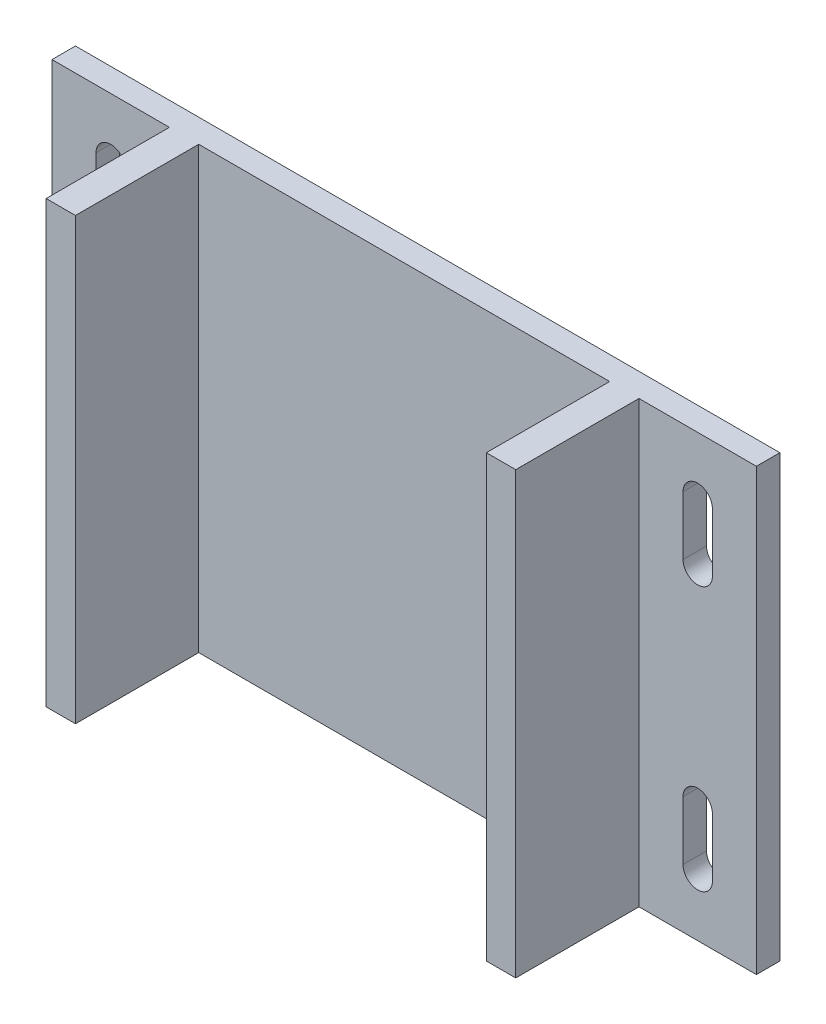
from build123d import *

# Parameters (mm, degrees)
SKETCH_1_W          = 120
SKETCH_1_H          = 75
EXTRUDE_1_DEPTH     = 4
SKETCH_2_W          = 5
SKETCH_2_H          = 75
EXTRUDE_2_DEPTH     = 21
CUT_EXTRUDE_1_DEPTH = 144.701078632


with BuildPart() as part:
    # 草图1 → 凸台-拉伸1 (new body)
    with BuildSketch(Plane.XY):
        with Locations((60, 37.5)):
            Rectangle(SKETCH_1_W, SKETCH_1_H)
    extrude(amount=EXTRUDE_1_DEPTH)

    # 草图2 → 凸台-拉伸2 (add)
    with BuildSketch(Plane.XY.offset(4)):
        with Locations((22.5, 37.5)):
            Rectangle(SKETCH_2_W, SKETCH_2_H)
        with Locations((97.5, 37.5)):
            Rectangle(SKETCH_2_W, SKETCH_2_H)
    extrude(amount=EXTRUDE_2_DEPTH)

    # 草图3 → 切除-拉伸1 (cut, through all)
    with BuildSketch(Plane(origin=(0, 0, 0), x_dir=(-1, 0, 0), z_dir=(0, 0, -1))):
        with BuildLine():
            Line((-112.5, 65), (-112.5, 55))
            ThreePointArc((-112.5, 55), (-110, 52.5), (-107.5, 55))
            Line((-107.5, 55), (-107.5, 65))
            ThreePointArc((-107.5, 65), (-110, 67.5), (-112.5, 65))
        make_face()
        with BuildLine():
            Line((-107.5, 10), (-107.5, 20))
            ThreePointArc((-107.5, 20), (-110, 22.5), (-112.5, 20))
            Line((-112.5, 20), (-112.5, 10))
            ThreePointArc((-112.5, 10), (-110, 7.5), (-107.5, 10))
        make_face()
        with BuildLine():
            Line((-7.5, 10), (-7.5, 20))
            ThreePointArc((-7.5, 20), (-10, 22.5), (-12.5, 20))
            Line((-12.5, 20), (-12.5, 10))
            ThreePointArc((-12.5, 10), (-10, 7.5), (-7.5, 10))
        make_face()
        with BuildLine():
            Line((-12.5, 65), (-12.5, 55))
            ThreePointArc((-12.5, 55), (-10, 52.5), (-7.5, 55))
            Line((-7.5, 55), (-7.5, 65))
            ThreePointArc((-7.5, 65), (-10, 67.5), (-12.5, 65))
        make_face()
    extrude(amount=-CUT_EXTRUDE_1_DEPTH, mode=Mode.SUBTRACT)


solid = part.part
